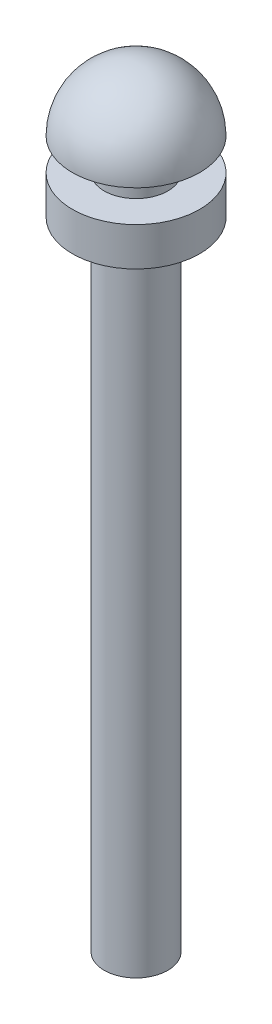
from build123d import *


with BuildPart() as part:
    # Sketch1 → Screw Revolve (revolve)
    with BuildSketch(Plane.XY, mode=Mode.PRIVATE) as screw_revolve_sk:
        with BuildLine():
            Line((0, 0), (1, 0))
            Line((1, 0), (1, 20))
            Line((1, 20), (2, 20))
            Line((2, 20), (2, 21.209302326))
            Line((2, 21.209302326), (1, 21.209302326))
            Line((1, 21.209302326), (1, 22.209302326))
            Line((1, 22.209302326), (2, 22.209302326))
            ThreePointArc((2, 22.209302326), (1.414213562, 23.623515888), (0, 24.209302326))
            Line((0, 24.209302326), (0, 0))
        make_face()
    revolve(screw_revolve_sk.sketch.rotate(Axis((0, 0, 0), (0, 1, 0)), 90), axis=Axis((0, 0, 0), (0, 1, 0)))


solid = part.part
